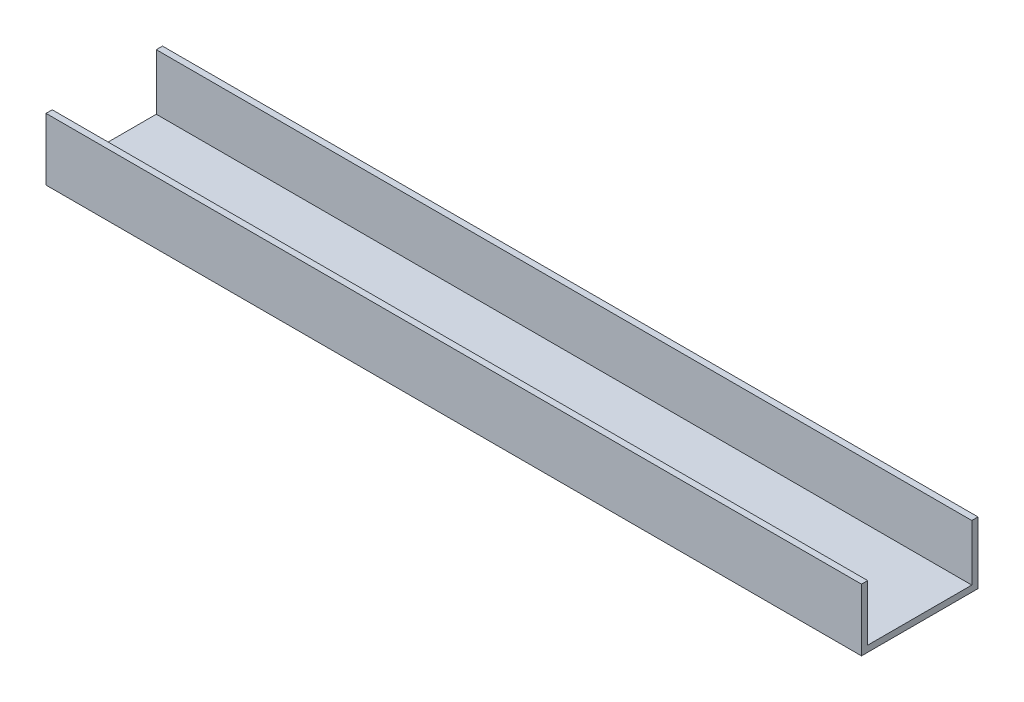
from build123d import *

# Parameters (mm, degrees)
SKETCH_1_W      = 525
SKETCH_1_H      = 75
EXTRUDE_1_DEPTH = 4
SKETCH_2_W      = 525
SKETCH_2_H      = 4
EXTRUDE_2_DEPTH = 36


with BuildPart() as part:
    # 스케치1 → 보스-돌출1 (new body)
    with BuildSketch(Plane(origin=(0, 0, 0), x_dir=(1, 0, 0), z_dir=(0, 1, 0))):
        with Locations((262.5, 37.5)):
            Rectangle(SKETCH_1_W, SKETCH_1_H)
    extrude(amount=EXTRUDE_1_DEPTH)

    # 스케치2 → 보스-돌출2 (add)
    with BuildSketch(Plane(origin=(0, 4, 0), x_dir=(1, 0, 0), z_dir=(0, 1, 0))):
        with Locations((262.5, 73)):
            Rectangle(SKETCH_2_W, SKETCH_2_H)
        with Locations((262.5, 2)):
            Rectangle(SKETCH_2_W, SKETCH_2_H)
    extrude(amount=EXTRUDE_2_DEPTH)


solid = part.part
